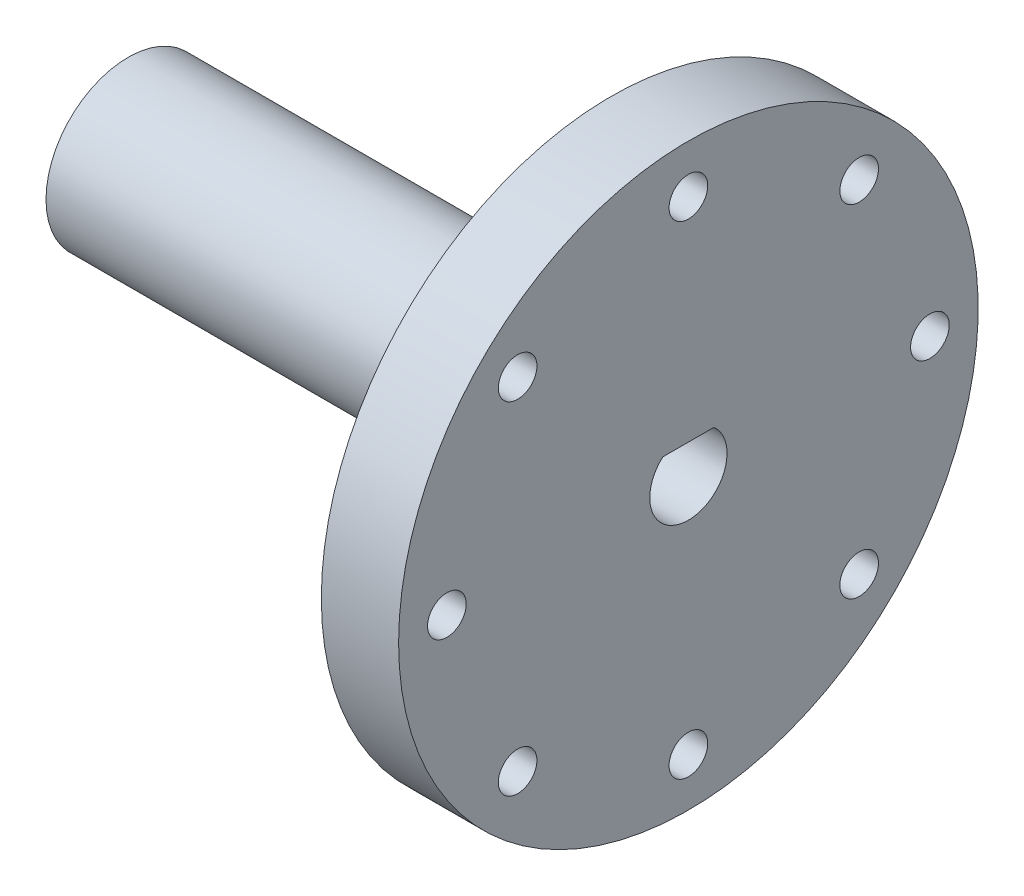
from build123d import *

# Parameters (mm, degrees)
SKETCH2_R           = 2
CUT_EXTRUDE1_DEPTH  = 10
BOSS_EXTRUDE1_DEPTH = 58
SKETCH4_R           = 10
BOSS_EXTRUDE2_DEPTH = 11


with BuildPart() as part:
    # Sketch1 → Revolve1 (revolve)
    with BuildSketch(Plane.XY, mode=Mode.PRIVATE) as revolve1_sk:
        Polygon((0, 4), (58, 4), (58, 30), (50, 30), (50, 8.5), (0, 8.5), align=None)
    revolve(revolve1_sk.sketch.rotate(Axis((0, 0, 0), (1, 0, 0)), 90), axis=Axis((0, 0, 0), (1, 0, 0)))

    # Sketch2 → Cut-Extrude1 (cut)
    with BuildSketch(Plane.ZY.offset(-50)):
        with Locations((0, 25)):
            Circle(SKETCH2_R)
        with Locations((17.67766953, 17.67766953)):
            Circle(SKETCH2_R)
        with Locations((25, 0)):
            Circle(SKETCH2_R)
        with Locations((17.67766953, -17.67766953)):
            Circle(SKETCH2_R)
        with Locations((0, -25)):
            Circle(SKETCH2_R)
        with Locations((-17.67766953, -17.67766953)):
            Circle(SKETCH2_R)
        with Locations((-25, 0)):
            Circle(SKETCH2_R)
        with Locations((-17.67766953, 17.67766953)):
            Circle(SKETCH2_R)
    extrude(amount=-CUT_EXTRUDE1_DEPTH, mode=Mode.SUBTRACT)

    # Sketch3 → Boss-Extrude1 (add, through all)
    with BuildSketch(Plane.ZY):
        with BuildLine():
            Line((-2.645751311, 3), (2.645751311, 3))
            ThreePointArc((2.645751311, 3), (0, 4), (-2.645751311, 3))
        make_face()
    extrude(amount=-BOSS_EXTRUDE1_DEPTH)

    # Sketch4 → Boss-Extrude2 (add)
    with BuildSketch(Plane.ZY.offset(-50)):
        with Locations(Location((0, 0, 0), (0, 0, 180))):
            Circle(SKETCH4_R)
        with BuildLine():
            Line((-2.645751311, 3), (2.645751311, 3))
            ThreePointArc((2.645751311, 3), (0, -4), (-2.645751311, 3))
        make_face(mode=Mode.SUBTRACT)
    extrude(amount=BOSS_EXTRUDE2_DEPTH)


solid = part.part
